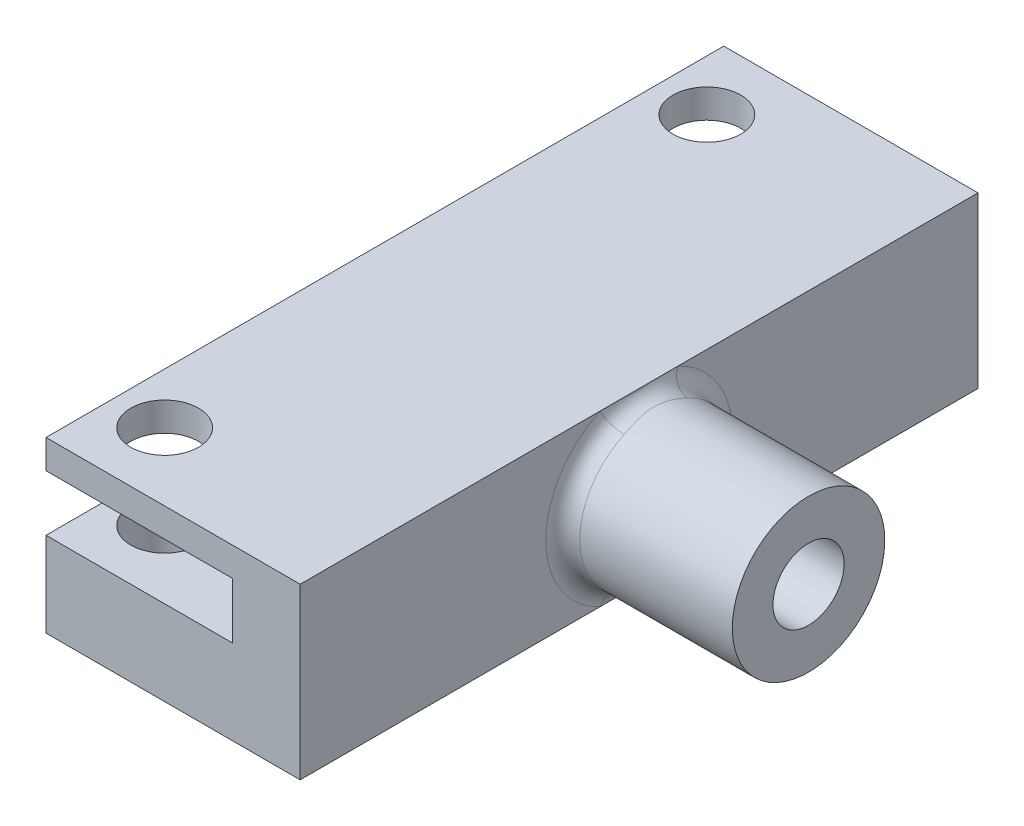
from build123d import *

# Parameters (mm, degrees)
BOSS_EXTRUDE1_DEPTH = 40
SKETCH4_R           = 4.5
SKETCH4_R_2         = 2.1
BOSS_EXTRUDE4_DEPTH = 10
FILLET2_R           = 1
SKETCH5_R           = 2
CUT_EXTRUDE1_DEPTH  = 44.543082261


with BuildPart() as part:
    # Sketch1 → Boss-Extrude1 (new body)
    with BuildSketch(Plane.XY):
        Polygon((-11, 3.3), (-11, 5), (4, 5), (4, -5), (-11, -5), (-11, 0), (0, 0), (0, 3.3), align=None)
    extrude(amount=BOSS_EXTRUDE1_DEPTH)

    # Sketch4 → Boss-Extrude4 (add)
    with BuildSketch(Plane(origin=(4, 0, 0), x_dir=(0, 0, -1), z_dir=(1, 0, 0))):
        with Locations(Location((-20, 0, 0), (0, 0, 90))):
            Circle(SKETCH4_R)
        with Locations(Location((-20, 0, 0), (0, 0, 90))):
            Circle(SKETCH4_R_2, mode=Mode.SUBTRACT)
    extrude(amount=BOSS_EXTRUDE4_DEPTH)

    # Fillet2
    fillet2_edges = [part.edges().sort_by_distance(p)[0] for p in [
        (4, -4.5, 20),
    ]]
    fillet(fillet2_edges, radius=FILLET2_R)

    # Sketch5 → Cut-Extrude1 (cut, through all)
    with BuildSketch(Plane(origin=(0, 5, 0), x_dir=(1, 0, 0), z_dir=(0, 1, 0))):
        with Locations(Location((-8, -36, 0), (0, 0, 270))):
            Circle(SKETCH5_R)
        with Locations(Location((-8, -4, 0), (0, 0, 270))):
            Circle(SKETCH5_R)
    extrude(amount=-CUT_EXTRUDE1_DEPTH, mode=Mode.SUBTRACT)


solid = part.part
